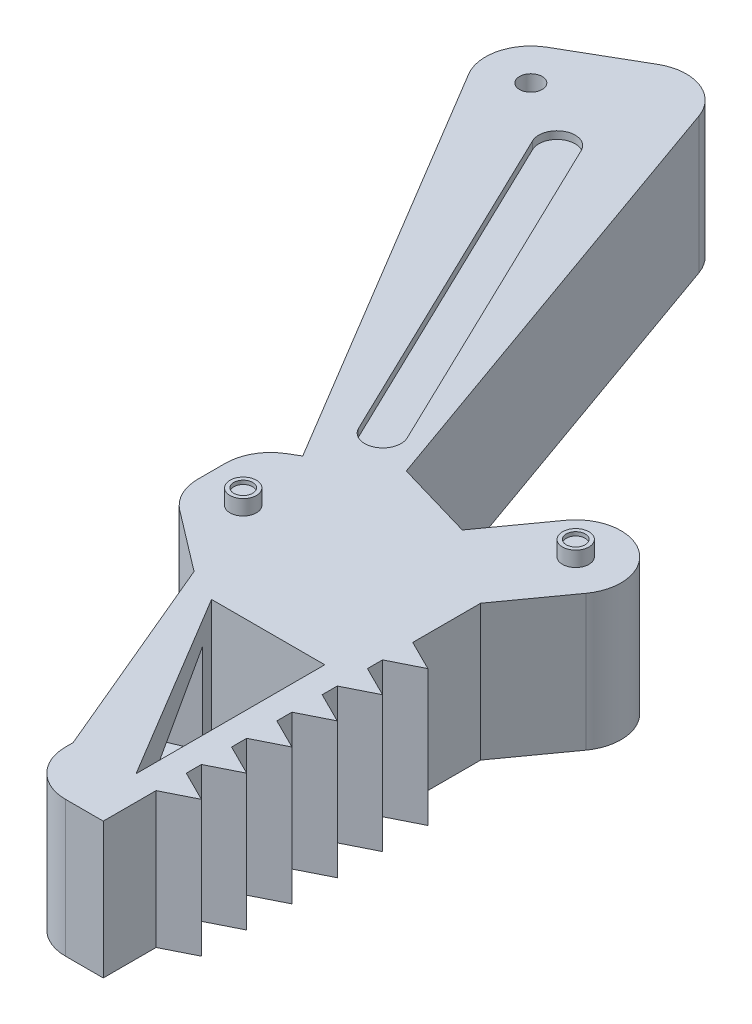
from build123d import *

# Parameters (mm, degrees)
BOSS_EXTRUDE1_DEPTH = 9
CUT_EXTRUDE1_DEPTH  = 26
BOSS_EXTRUDE2_DEPTH = 18
LPATTERN1_COUNT     = 6
LPATTERN1_PITCH     = 6
FILLET1_R           = 6
FILLET2_R           = 6
FILLET3_R           = 6
SKETCH4_R           = 1.5
CUT_EXTRUDE2_DEPTH  = 88.522155905
CUT_EXTRUDE3_DEPTH  = 9
SKETCH6_R           = 1.75
BOSS_EXTRUDE3_DEPTH = 2
SKETCH7_R           = 1.25
CUT_EXTRUDE4_DEPTH  = 0.5
CUT_EXTRUDE5_DEPTH  = 1


with BuildPart() as part:
    # Sketch1 → Boss-Extrude1 (new, symmetric)
    with BuildSketch(Plane(origin=(0, 0, 0), x_dir=(1, 0, 0), z_dir=(0, 1, 0))):
        with BuildLine():
            Line((2.514105873, -21.575108952), (-33.455759115, 38.476275817))
            Line((-33.455759115, 38.476275817), (-12.667369645, 50.469726664))
            Line((-12.667369645, 50.469726664), (11.092875126, -16.436556811))
            Line((11.092875126, -16.436556811), (21.575489497, -19.497759324))
            Line((21.575489497, -19.497759324), (27.289214074, -11.555417826))
            ThreePointArc((27.289214074, -11.555417826), (35.663709394, -10.188732731), (37.030394489, -18.56322805))
            Line((37.030394489, -18.56322805), (31.190552636, -26.680878395))
            Line((31.190552636, -26.680878395), (31.190552636, -76.680878395))
            Line((31.190552636, -76.680878395), (20.190552636, -76.680878395))
            Line((20.190552636, -76.680878395), (20.190552636, -69.680878395))
            Line((20.190552636, -69.680878395), (8.563166422, -42.02579044))
            Line((8.563166422, -42.02579044), (-1.775278753, -34.144385023))
            Line((-1.775278753, -34.144385023), (-1.775278753, -24.144385023))
            Line((-1.775278753, -24.144385023), (2.514105873, -21.575108952))
        make_face()
    extrude(amount=BOSS_EXTRUDE1_DEPTH, both=True)

    # Sketch2 → Cut-Extrude1 (cut)
    with BuildSketch(Plane(origin=(0, 9, 0), x_dir=(1, 0, 0), z_dir=(0, 1, 0))):
        Polygon((12.928109305, -44.071308637), (27.928109305, -44.071308637), (27.928109305, -69.071308637), align=None)
    extrude(amount=-CUT_EXTRUDE1_DEPTH, mode=Mode.SUBTRACT)

    # Sketch3 → Boss-Extrude2 (add)
    with BuildSketch(Plane(origin=(0, 9, 0), x_dir=(1, 0, 0), z_dir=(0, 1, 0))):
        Polygon((31.190552636, -69.680878395), (31.190552636, -65.680878395), (35.190552636, -67.680878395), align=None)
    boss_extrude2 = extrude(amount=-BOSS_EXTRUDE2_DEPTH)

    # LPattern1: Boss-Extrude2 ×6
    with Locations(*[(0, 0, -i * LPATTERN1_PITCH) for i in range(1, LPATTERN1_COUNT)]):
        add(boss_extrude2)

    # Fillet1
    fillet1_edges = [part.edges().sort_by_distance(p)[0] for p in [
        (-33.455759115, 0, -38.476275817),
        (-12.667369645, 0, -50.469726664),
    ]]
    fillet(fillet1_edges, radius=FILLET1_R)

    # Fillet2
    fillet2_edges = [part.edges().sort_by_distance(p)[0] for p in [
        (-1.775278753, 0, 34.144385023),
        (-1.775278753, 0, 24.144385023),
    ]]
    fillet(fillet2_edges, radius=FILLET2_R)

    # Fillet3
    fillet3_edges = [part.edges().sort_by_distance(p)[0] for p in [
        (20.190552636, 0, 76.680878395),
    ]]
    fillet(fillet3_edges, radius=FILLET3_R)

    # Sketch4 → Cut-Extrude2 (cut, through all)
    with BuildSketch(Plane(origin=(0, 9, 0), x_dir=(1, 0, 0), z_dir=(0, 1, 0))):
        with Locations(Location((-25.174418311, 36.32708835, 0), (0, 0, 270))):
            Circle(SKETCH4_R)
    extrude(amount=-CUT_EXTRUDE2_DEPTH, mode=Mode.SUBTRACT)

    # Sketch5 → Cut-Extrude3 (cut)
    with BuildSketch(Plane(origin=(-7.738353784, 0, 3.25353614), x_dir=(0.38757954045785686, 0, 0.9218362651894731), z_dir=(-0.921836265189473, 0, 0.3875795404578568))):
        Polygon((49.059805807, 6), (49.059805807, -6), (70.059805807, -8.207927909), (70.059805807, 3.792072091), align=None)
    extrude(amount=-CUT_EXTRUDE3_DEPTH, mode=Mode.SUBTRACT)

    # Sketch6 → Boss-Extrude3 (add)
    with BuildSketch(Plane(origin=(0, 9, 0), x_dir=(1, 0, 0), z_dir=(0, 1, 0))):
        with Locations(Location((32.159804282, -15.059322938, 0), (0, 0, 270))):
            Circle(SKETCH6_R)
        with Locations(Location((4.224721247, -31.173767393, 0), (0, 0, 270))):
            Circle(SKETCH6_R)
    boss_extrude3 = extrude(amount=BOSS_EXTRUDE3_DEPTH)

    # Sketch7 → Cut-Extrude4 (cut)
    with BuildSketch(Plane(origin=(0, 11, 0), x_dir=(1, 0, 0), z_dir=(0, 1, 0))):
        with Locations(Location((4.224721247, -31.173767393, 0), (0, 0, 270))):
            Circle(SKETCH7_R)
        with Locations(Location((32.159804282, -15.059322938, 0), (0, 0, 270))):
            Circle(SKETCH7_R)
    cut_extrude4 = extrude(amount=-CUT_EXTRUDE4_DEPTH, mode=Mode.SUBTRACT)

    # Sketch8 → Cut-Extrude5 (cut)
    with BuildSketch(Plane(origin=(0, 9, 0), x_dir=(1, 0, 0), z_dir=(0, 1, 0))):
        with BuildLine():
            Line((-14.087027859, 31.922607918), (7.364953265, -12.596019576))
            ThreePointArc((7.364953265, -12.596019576), (6.240093161, -15.813119473), (3.022993263, -14.688259369))
            Line((3.022993263, -14.688259369), (-18.428987861, 29.830368124))
            ThreePointArc((-18.428987861, 29.830368124), (-17.304127757, 33.047468022), (-14.087027859, 31.922607918))
        make_face()
    cut_extrude5 = extrude(amount=-CUT_EXTRUDE5_DEPTH, mode=Mode.SUBTRACT)

    # Mirror1: Boss-Extrude3, Cut-Extrude4, Cut-Extrude5 across plane
    add(boss_extrude3.mirror(Plane.ZX))
    add(cut_extrude4.mirror(Plane.ZX), mode=Mode.SUBTRACT)
    add(cut_extrude5.mirror(Plane.ZX), mode=Mode.SUBTRACT)


solid = part.part
